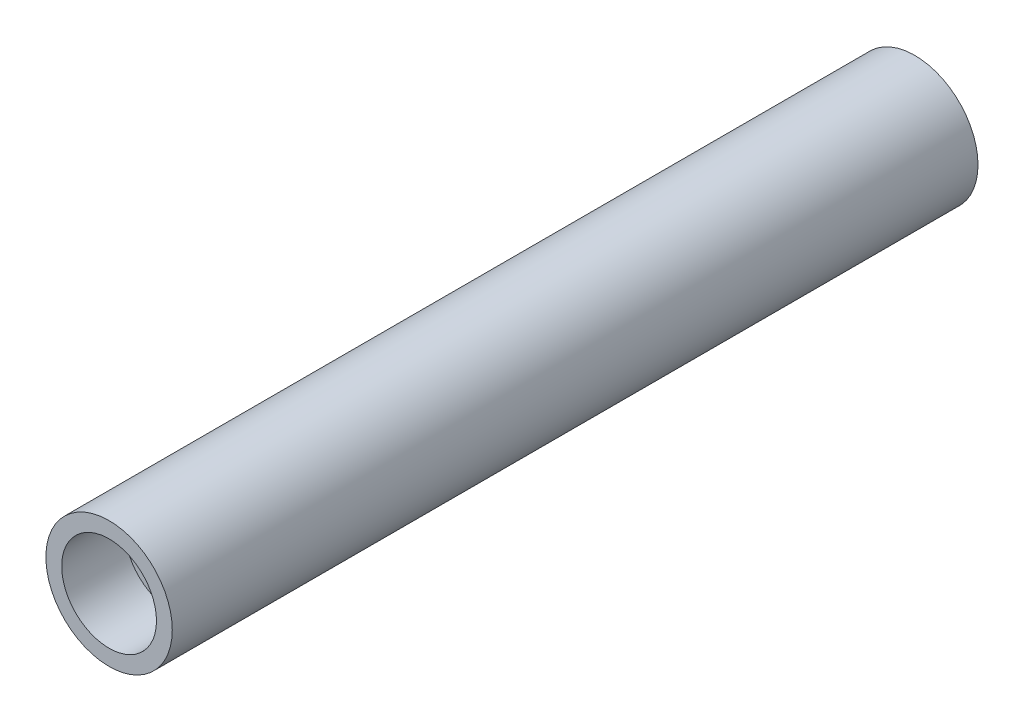
from build123d import *

# Parameters (mm, degrees)
SKETCH1_R                        = 8
SKETCH1_R_2                      = 3.3
FRAME_BENCH_COLUMN_DEPTH         = 102
SKETCH2_R                        = 6
UPPER_NUT_CLEARANCE_POCKET_DEPTH = 8


with BuildPart() as part:
    # Sketch1 → Frame_Bench_Column (new body)
    with BuildSketch(Plane.XY):
        Circle(SKETCH1_R)
        Circle(SKETCH1_R_2, mode=Mode.SUBTRACT)
    extrude(amount=FRAME_BENCH_COLUMN_DEPTH)

    # Sketch2 → Upper_Nut_Clearance_Pocket (cut)
    with BuildSketch(Plane.XY.offset(102)):
        Circle(SKETCH2_R)
    extrude(amount=-UPPER_NUT_CLEARANCE_POCKET_DEPTH, mode=Mode.SUBTRACT)


solid = part.part
